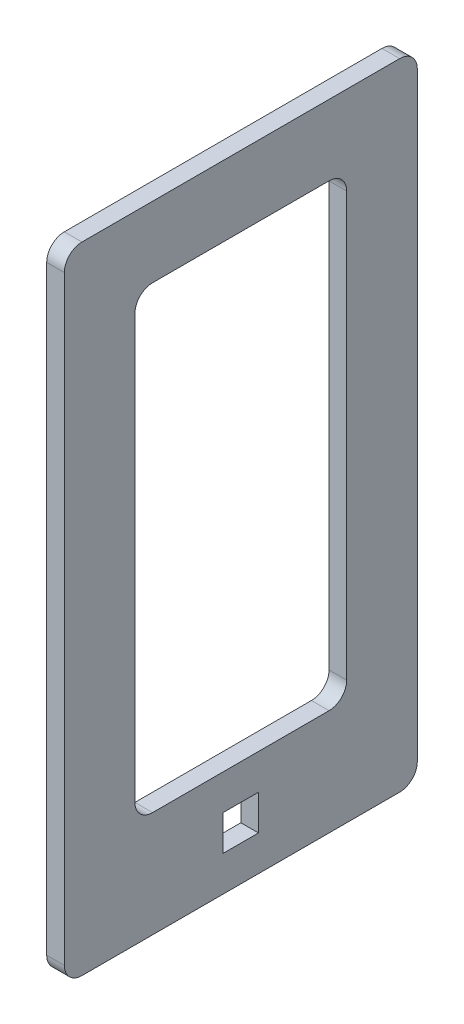
from build123d import *

# Parameters (mm, degrees)
BOSS_EXTRUDE2_DEPTH = 6.35
CUT_EXTRUDE1_REACH  = 132.909
SKETCH4_W           = 12.7
SKETCH4_H           = 12.7


with BuildPart() as part:
    # Sketch3 → Boss-Extrude2 (new body)
    with BuildSketch(Plane(origin=(0, 0, 0), x_dir=(0, 0, -1), z_dir=(1, 0, 0))):
        with BuildLine():
            Line((-57.15, -114.3), (57.15, -114.3))
            ThreePointArc((57.15, -114.3), (61.640128061, -112.440128061), (63.5, -107.95))
            Line((63.5, -107.95), (63.5, 107.95))
            ThreePointArc((63.5, 107.95), (61.640128061, 112.440128061), (57.15, 114.3))
            Line((57.15, 114.3), (-57.15, 114.3))
            ThreePointArc((-57.15, 114.3), (-61.640128061, 112.440128061), (-63.5, 107.95))
            Line((-63.5, 107.95), (-63.5, -107.95))
            ThreePointArc((-63.5, -107.95), (-61.640128061, -112.440128061), (-57.15, -114.3))
        make_face()
        with BuildLine():
            Line((-31.75, -76.2), (31.75, -76.2))
            ThreePointArc((31.75, -76.2), (36.240128061, -74.340128061), (38.1, -69.85))
            Line((38.1, -69.85), (38.1, 82.55))
            ThreePointArc((38.1, 82.55), (36.240128061, 87.040128061), (31.75, 88.9))
            Line((31.75, 88.9), (-31.75, 88.9))
            ThreePointArc((-31.75, 88.9), (-36.240128061, 87.040128061), (-38.1, 82.55))
            Line((-38.1, 82.55), (-38.1, -69.85))
            ThreePointArc((-38.1, -69.85), (-36.240128061, -74.340128061), (-31.75, -76.2))
        make_face(mode=Mode.SUBTRACT)
    extrude(amount=BOSS_EXTRUDE2_DEPTH)

    # Sketch4 → Cut-Extrude1 (cut, up to next)
    with BuildSketch(Plane(origin=(6.35, 0, 0), x_dir=(0, 0, -1), z_dir=(1, 0, 0)), mode=Mode.PRIVATE) as cut_extrude1_sk1:
        with Locations((0, -95.25)):
            Rectangle(SKETCH4_W, SKETCH4_H)
    cut_extrude1_tool1 = extrude(cut_extrude1_sk1.sketch, amount=-CUT_EXTRUDE1_REACH, mode=Mode.PRIVATE) & part.part
    add(cut_extrude1_tool1.solids().sort_by_distance((6.35, -95.25, 0))[0], mode=Mode.SUBTRACT)


solid = part.part
